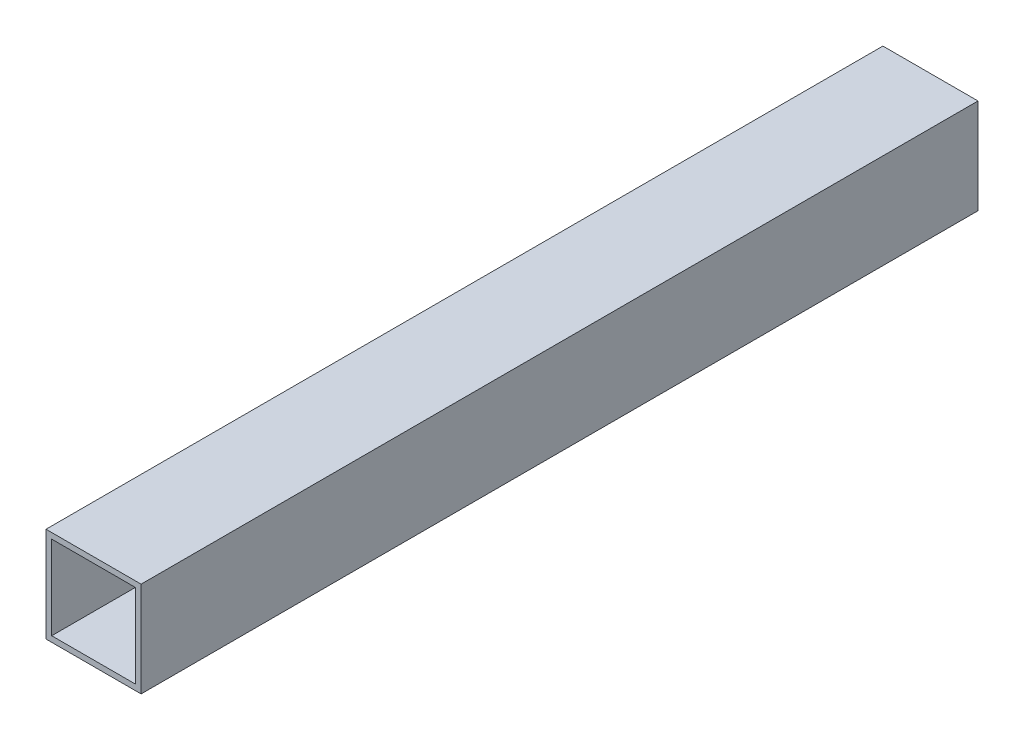
from build123d import *

# Parameters (mm, degrees)
SKETCH_1_W      = 25
SKETCH_1_H      = 25
SKETCH_1_W_2    = 22
SKETCH_1_H_2    = 22
EXTRUDE_1_DEPTH = 220


with BuildPart() as part:
    # Эскиз1 → Вытянуть-Тонкостенный1 (new body)
    with BuildSketch(Plane.XY):
        Rectangle(SKETCH_1_W, SKETCH_1_H)
        Rectangle(SKETCH_1_W_2, SKETCH_1_H_2, mode=Mode.SUBTRACT)
    extrude(amount=EXTRUDE_1_DEPTH)


solid = part.part
